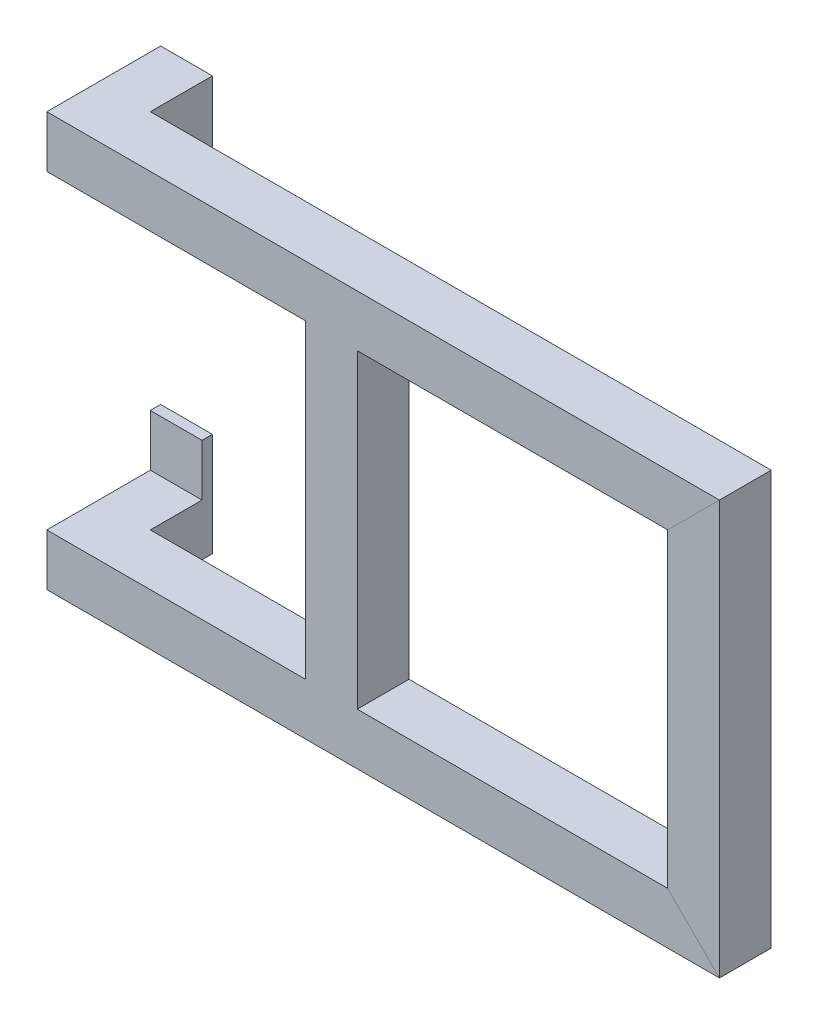
from build123d import *

# Parameters (mm, degrees)
SKETCH8_W           = 50
SKETCH8_H           = 50
SKETCH9_W           = 50
SKETCH9_H           = 50
BOSS_EXTRUDE1_DEPTH = 110
SKETCH10_W          = 50
SKETCH10_H          = 400
BOSS_EXTRUDE2_DEPTH = 50
SKETCH11_W          = 50
SKETCH11_H          = 100
BOSS_EXTRUDE3_DEPTH = 10


with BuildPart() as part:
    # Sweep1: sweep along a path in Sketch1
    with BuildLine(Plane.XY) as sweep1_path:
        Line((-325, 200), (325, 200))
        Line((325, 200), (325, -200))
        Line((325, -200), (-325, -200))
    # Sketch8 → Sweep1 (sweep)
    with BuildSketch(Plane(origin=(0, 0, 0), x_dir=(0, 0, -1), z_dir=(1, 0, 0))):
        with Locations((25, 175)):
            Rectangle(SKETCH8_W, SKETCH8_H)
    sweep(path=sweep1_path.line, transition=Transition.RIGHT)

    # Sketch9 → Boss-Extrude1 (add)
    with BuildSketch(Plane.XY):
        with Locations((-300, 175)):
            Rectangle(SKETCH9_W, SKETCH9_H)
        with Locations((-300, -175)):
            Rectangle(SKETCH9_W, SKETCH9_H)
    extrude(amount=-BOSS_EXTRUDE1_DEPTH)

    # Sketch10 → Boss-Extrude2 (add)
    with BuildSketch(Plane.XY):
        with Locations((-50, 0)):
            Rectangle(SKETCH10_W, SKETCH10_H)
    extrude(amount=-BOSS_EXTRUDE2_DEPTH)

    # Sketch11 → Boss-Extrude3 (add)
    with BuildSketch(Plane(origin=(0, 0, -110), x_dir=(-1, 0, 0), z_dir=(0, 0, -1))):
        with Locations((300, 150)):
            Rectangle(SKETCH11_W, SKETCH11_H)
        with Locations((300, -150)):
            Rectangle(SKETCH11_W, SKETCH11_H)
    extrude(amount=-BOSS_EXTRUDE3_DEPTH)


solid = part.part
